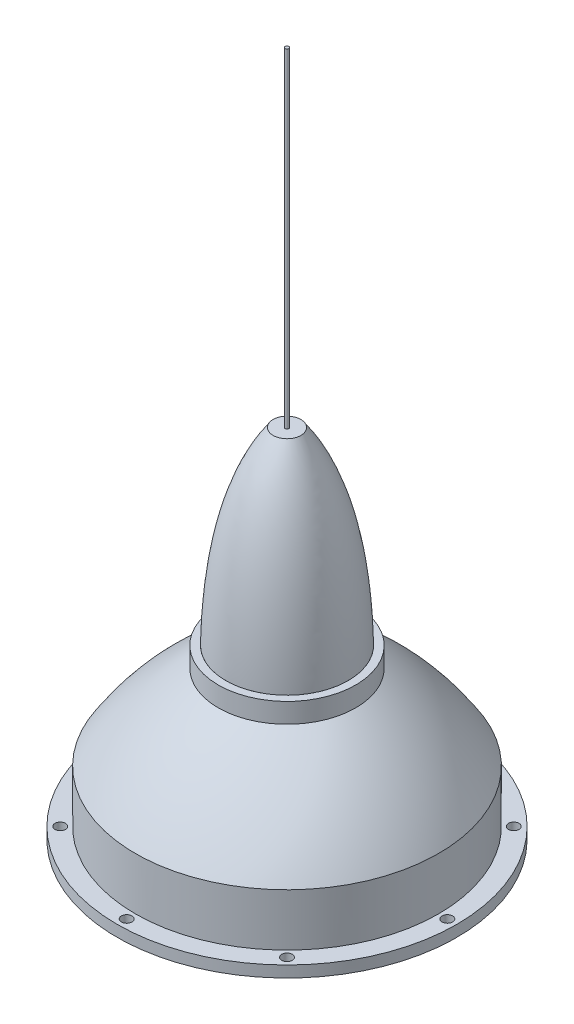
from build123d import *

# Parameters (mm, degrees)
SKETCH3_R                = 45
SKETCH3_R_2              = 37.359399673
BOSS_EXTRUDE2_DEPTH      = 6
SKETCH6_R                = 41.88975279
SKETCH6_R_2              = 40.183847225
CUT_EXTRUDE1_DEPTH       = 5
SKETCH7_R                = 47
SKETCH7_R_2              = 37.359399673
BOSS_EXTRUDE4_DEPTH      = 6
SKETCH4_R                = 1.4
CUT_EXTRUDE2_DEPTH       = 6
SKETCH8_R                = 47
SKETCH8_R_2              = 45
CUT_EXTRUDE3_DEPTH       = 10
SKETCH9_R                = 45
SKETCH9_R_2              = 37.359399673
CUT_EXTRUDE4_DEPTH       = 4
BOSS_EXTRUDE5_DEPTH      = 4
BOSS_EXTRUDE5_DEPTH_BACK = 3
SKETCH10_R               = 18.219556271
SKETCH10_R_2             = 16.219556271
BOSS_EXTRUDE6_DEPTH      = 8
BOSS_EXTRUDE6_DEPTH_BACK = 5
SKETCH9_2_R              = 45
SKETCH9_2_R_2            = 37.359399673
CUT_EXTRUDE5_START       = -11
SKETCH13_R               = 45
SKETCH13_R_2             = 40.183847225
CUT_EXTRUDE5_DEPTH       = 11
SKETCH4_2_R              = 1.4
CUT_EXTRUDE6_DEPTH       = 10
SKETCH16_R               = 0.5
BOSS_EXTRUDE8_DEPTH      = 87.2


with BuildPart() as part:
    # Sketch1 → Revolve1 (revolve)
    with BuildSketch(Plane.XY):
        with BuildLine():
            Line((0, 0), (0, 32.557113406))
            Line((0, 32.557113406), (16.219556271, 32.557113406))
            add(Edge.make_bspline(
                [(16.219556271, 32.557113406), (28.767144336, 24.975248592), (38.36062558, 14.122877456), (45, 0)],
                knots=[0.282784637, 0.282784637, 0.282784637, 0.282784637, 1, 1, 1, 1], degree=3))
            Line((45, 0), (0, 0))
        make_face()
    revolve(axis=Axis((0, 0, 0), (0, 1, 0)))

    # Sketch2 → Cut-Revolve1 (revolve, cut)
    with BuildSketch(Plane.XY):
        with BuildLine():
            Line((16.219556271, 32.557113406), (16.219556271, 29.246360927))
            add(Edge.make_bspline(
                [(40.448126072, 0), (34.99854468, 12.078079845), (26.922354747, 21.826866821), (16.219556271, 29.246360927)],
                knots=[0, 0, 0, 0, 0.864735691, 0.864735691, 0.864735691, 0.864735691], degree=3))
            Line((40.448126072, 0), (0, 0))
            Line((0, 0), (0, 32.557113406))
            Line((0, 32.557113406), (16.219556271, 32.557113406))
        make_face()
    revolve(axis=Axis((0, 0, 0), (0, 1, 0)), mode=Mode.SUBTRACT)

    # Sketch3 → Boss-Extrude2 (add)
    with BuildSketch(Plane(origin=(0, 0, 0), x_dir=(-1, 0, 0), z_dir=(0, -1, 0))):
        Circle(SKETCH3_R)
        Circle(SKETCH3_R_2, mode=Mode.SUBTRACT)
    extrude(amount=-BOSS_EXTRUDE2_DEPTH)

    # Sketch6 → Cut-Extrude1 (cut)
    with BuildSketch(Plane(origin=(0, 6, 0), x_dir=(-1, 0, 0), z_dir=(0, -1, 0))):
        Circle(SKETCH6_R)
        Circle(SKETCH6_R_2, mode=Mode.SUBTRACT)
    extrude(amount=-CUT_EXTRUDE1_DEPTH, mode=Mode.SUBTRACT)

    # Sketch7 → Boss-Extrude4 (add)
    with BuildSketch(Plane(origin=(0, 0, 0), x_dir=(-1, 0, 0), z_dir=(0, -1, 0))):
        Circle(SKETCH7_R)
        Circle(SKETCH7_R_2, mode=Mode.SUBTRACT)
    extrude(amount=-BOSS_EXTRUDE4_DEPTH)

    # Sketch4 → Cut-Extrude2 (cut)
    with BuildSketch(Plane(origin=(0, 0, 0), x_dir=(-1, 0, 0), z_dir=(0, -1, 0))):
        with Locations((-42.5, 0)):
            Circle(SKETCH4_R)
        with Locations((-30.0520382, -30.0520382)):
            Circle(SKETCH4_R)
        with Locations((0, -42.5)):
            Circle(SKETCH4_R)
        with Locations((30.0520382, -30.0520382)):
            Circle(SKETCH4_R)
        with Locations((42.5, 0)):
            Circle(SKETCH4_R)
        with Locations((30.0520382, 30.0520382)):
            Circle(SKETCH4_R)
        with Locations((0, 42.5)):
            Circle(SKETCH4_R)
        with Locations((-30.0520382, 30.0520382)):
            Circle(SKETCH4_R)
    extrude(amount=-CUT_EXTRUDE2_DEPTH, mode=Mode.SUBTRACT)

    # Sketch8 → Cut-Extrude3 (cut)
    with BuildSketch(Plane(origin=(0, 0, 0), x_dir=(-1, 0, 0), z_dir=(0, -1, 0))):
        Circle(SKETCH8_R)
        Circle(SKETCH8_R_2, mode=Mode.SUBTRACT)
    extrude(amount=-CUT_EXTRUDE3_DEPTH, mode=Mode.SUBTRACT)

    # Sketch9 → Cut-Extrude4 (cut)
    with BuildSketch(Plane(origin=(0, 0, 0), x_dir=(-1, 0, 0), z_dir=(0, -1, 0))):
        Circle(SKETCH9_R)
        Circle(SKETCH9_R_2, mode=Mode.SUBTRACT)
    extrude(amount=-CUT_EXTRUDE4_DEPTH, mode=Mode.SUBTRACT)

    # Sketch10 → Boss-Extrude5 (add, two sides: drawn at the far end of the back side and taken through both)
    with BuildSketch(Plane(origin=(0, 32.557113406, 0), x_dir=(1, 0, 0), z_dir=(0, 1, 0)).offset(-BOSS_EXTRUDE5_DEPTH_BACK)):
        Circle(SKETCH10_R)
        Circle(SKETCH10_R_2, mode=Mode.SUBTRACT)
    extrude(amount=BOSS_EXTRUDE5_DEPTH + BOSS_EXTRUDE5_DEPTH_BACK)

    # Sketch9<2> → Boss-Extrude6 (add, two sides: drawn at the far end of the back side and taken through both)
    with BuildSketch(Plane(origin=(0, 0, 0), x_dir=(-1, 0, 0), z_dir=(0, -1, 0)).offset(-BOSS_EXTRUDE6_DEPTH_BACK)):
        Circle(SKETCH9_2_R)
        Circle(SKETCH9_2_R_2, mode=Mode.SUBTRACT)
    extrude(amount=BOSS_EXTRUDE6_DEPTH + BOSS_EXTRUDE6_DEPTH_BACK)

    # Sketch13 → Cut-Extrude5 (cut)
    with BuildSketch(Plane(origin=(0, 6, 0), x_dir=(1, 0, 0), z_dir=(0, 1, 0)).offset(CUT_EXTRUDE5_START)):
        Circle(SKETCH13_R)
        Circle(SKETCH13_R_2, mode=Mode.SUBTRACT)
    extrude(amount=CUT_EXTRUDE5_DEPTH, mode=Mode.SUBTRACT)

    # Sketch4<2> → Cut-Extrude6 (cut)
    with BuildSketch(Plane(origin=(0, 0, 0), x_dir=(-1, 0, 0), z_dir=(0, -1, 0))):
        with Locations((-42.5, 0)):
            Circle(SKETCH4_2_R)
        with Locations((-30.0520382, -30.0520382)):
            Circle(SKETCH4_2_R)
        with Locations((0, -42.5)):
            Circle(SKETCH4_2_R)
        with Locations((30.0520382, -30.0520382)):
            Circle(SKETCH4_2_R)
        with Locations((42.5, 0)):
            Circle(SKETCH4_2_R)
        with Locations((30.0520382, 30.0520382)):
            Circle(SKETCH4_2_R)
        with Locations((0, 42.5)):
            Circle(SKETCH4_2_R)
        with Locations((-30.0520382, 30.0520382)):
            Circle(SKETCH4_2_R)
    extrude(amount=CUT_EXTRUDE6_DEPTH, mode=Mode.SUBTRACT)


with BuildPart() as body_2:
    # Sketch15 → Revolve2 (revolve)
    with BuildSketch(Plane.XY):
        with BuildLine():
            Line((0, 86.557113406), (0, 36.557113406))
            Line((0, 36.557113406), (16.219556271, 36.557113406))
            add(Edge.make_bspline(
                [(3.670047802, 86.557113406), (15.635539023, 69.889064581), (16.219556271, 36.557113406)],
                knots=[0, 0, 0, 1, 1, 1], degree=2))
            Line((3.670047802, 86.557113406), (0, 86.557113406))
        make_face()
    revolve(axis=Axis((0, 36.557113406, 0), (0, 1, 0)))

    # Sketch16 → Boss-Extrude8 (add)
    with BuildSketch(Plane(origin=(0, 86.557113406, 0), x_dir=(1, 0, 0), z_dir=(0, 1, 0))):
        Circle(SKETCH16_R)
    extrude(amount=BOSS_EXTRUDE8_DEPTH)


solid = Compound([part.part, body_2.part])
